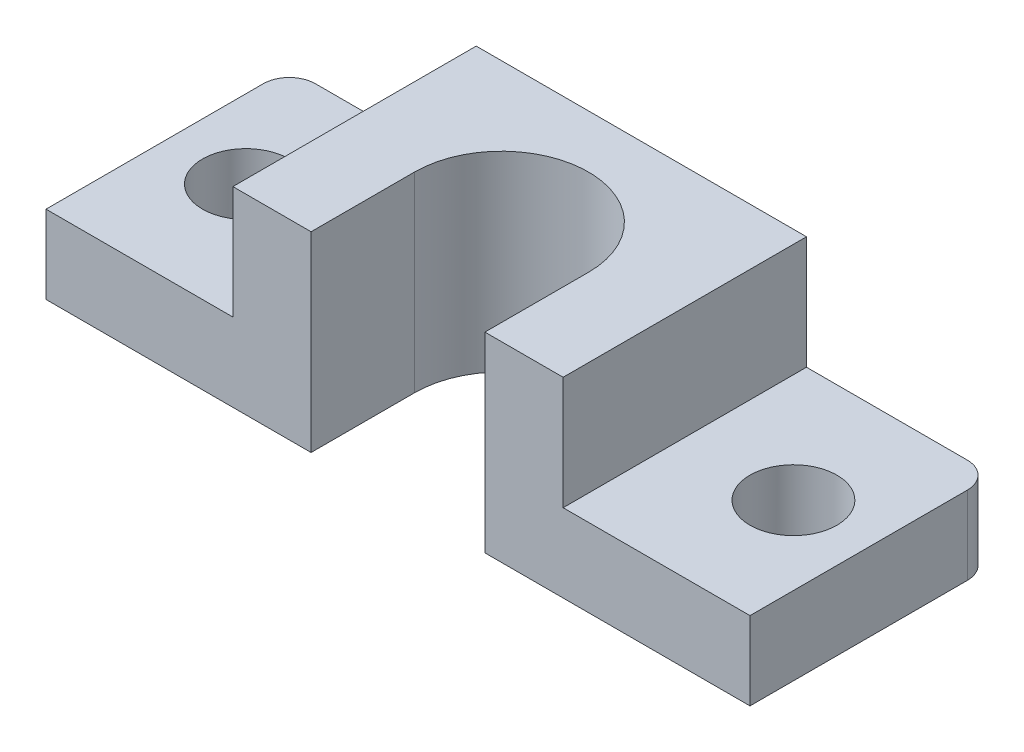
from build123d import *

# Parameters (mm, degrees)
SKETCH_1_W          = 81
SKETCH_1_H          = 28
EXTRUDE_1_DEPTH     = 9
SKETCH_2_W          = 38
SKETCH_2_H          = 28
EXTRUDE_2_DEPTH     = 13
CUT_EXTRUDE_1_DEPTH = 33
SKETCH_4_R          = 5
CUT_EXTRUDE_2_DEPTH = 33
SKETCH_5_R          = 5
CUT_EXTRUDE_3_DEPTH = 33
FILLET_1_R          = 3


with BuildPart() as part:
    # 스케치1 → 보스-돌출1 (new body)
    with BuildSketch(Plane(origin=(0, 0, 0), x_dir=(1, 0, 0), z_dir=(0, 1, 0))):
        with Locations((40.5, 14)):
            Rectangle(SKETCH_1_W, SKETCH_1_H)
    extrude(amount=EXTRUDE_1_DEPTH)

    # 스케치2 → 보스-돌출2 (add)
    with BuildSketch(Plane(origin=(0, 9, 0), x_dir=(1, 0, 0), z_dir=(0, 1, 0))):
        with Locations((40.5, 14)):
            Rectangle(SKETCH_2_W, SKETCH_2_H)
    extrude(amount=EXTRUDE_2_DEPTH)

    # 스케치3 → 컷-돌출1 (cut)
    with BuildSketch(Plane(origin=(0, 22, 0), x_dir=(1, 0, 0), z_dir=(0, 1, 0))):
        with BuildLine():
            Line((30.5, 0), (30.5, 11.914888689))
            ThreePointArc((30.5, 11.914888689), (40.5, 21.914888689), (50.5, 11.914888689))
            Line((50.5, 11.914888689), (50.5, 0))
            Line((50.5, 0), (30.5, 0))
        make_face()
    extrude(amount=-CUT_EXTRUDE_1_DEPTH, mode=Mode.SUBTRACT)

    # 스케치4 → 컷-돌출2 (cut)
    with BuildSketch(Plane(origin=(0, 9, 0), x_dir=(1, 0, 0), z_dir=(0, 1, 0))):
        with Locations(Location((9, 14, 0), (0, 0, 270))):
            Circle(SKETCH_4_R)
    extrude(amount=-CUT_EXTRUDE_2_DEPTH, mode=Mode.SUBTRACT)

    # 스케치5 → 컷-돌출3 (cut)
    with BuildSketch(Plane(origin=(0, 9, 0), x_dir=(1, 0, 0), z_dir=(0, 1, 0))):
        with Locations(Location((72, 14, 0), (0, 0, 270))):
            Circle(SKETCH_5_R)
    extrude(amount=-CUT_EXTRUDE_3_DEPTH, mode=Mode.SUBTRACT)

    # 필렛1
    fillet_1_edges = [part.edges().sort_by_distance(p)[0] for p in [
        (0, 4.5, -28),
        (81, 4.5, -28),
    ]]
    fillet(fillet_1_edges, radius=FILLET_1_R)


solid = part.part
